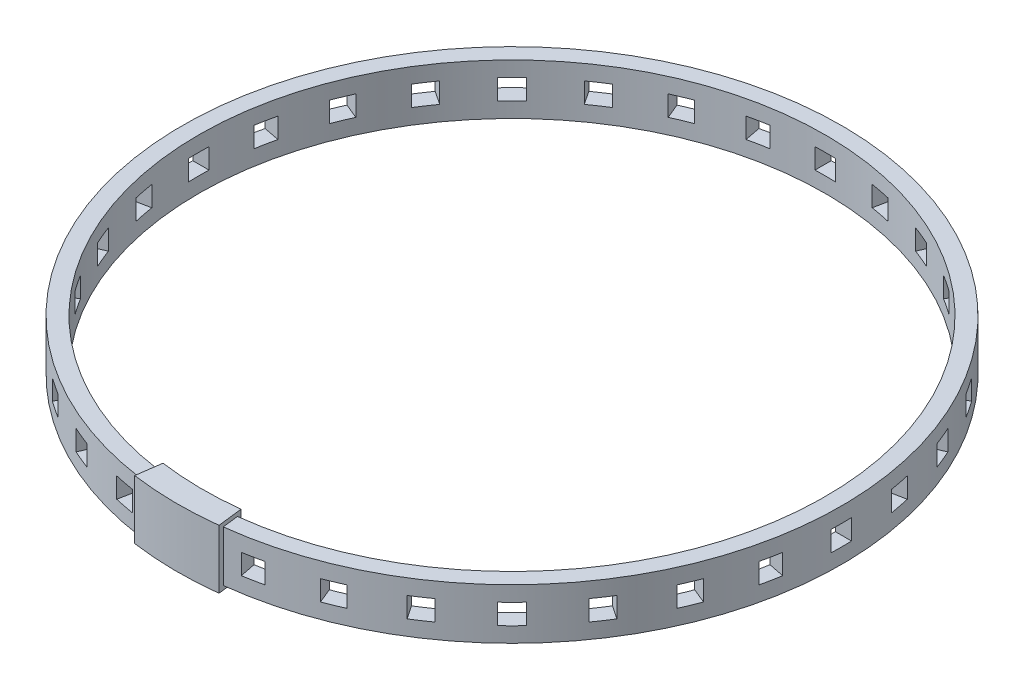
from build123d import *

# Parameters (mm, degrees)
SKETCH1_R                       = 81.15
SKETCH1_R_2                     = 77.15
BOSS_EXTRUDE1_DEPTH             = 12.5
SKETCH2_W                       = 5
SKETCH2_H                       = 5
CUT_EXTRUDE2_DEPTH              = 116.44217167
CIRPATTERN1_COUNT               = 16
CIRPATTERN1_ANGLE               = 168.75
CIRPATTERN1_THE_OTHER_WAY_COUNT = 16
CIRPATTERN1_THE_OTHER_WAY_ANGLE = 168.75
BOSS_EXTRUDE2_DEPTH             = 1
BOSS_EXTRUDE2_DEPTH_BACK        = 13.5


with BuildPart() as part:
    # Sketch1 → Boss-Extrude1 (new body)
    with BuildSketch(Plane(origin=(0, 0, 0), x_dir=(1, 0, 0), z_dir=(0, 1, 0))):
        with Locations(Location((0, 0, 0), (0, 0, 270))):
            Circle(SKETCH1_R)
        with Locations(Location((0, 0, 0), (0, 0, 270))):
            Circle(SKETCH1_R_2, mode=Mode.SUBTRACT)
    extrude(amount=BOSS_EXTRUDE1_DEPTH)

    # Sketch2 → Cut-Extrude2 (cut, through all)
    with BuildSketch(Plane.XY):
        with Locations((0, 6.25)):
            Rectangle(SKETCH2_W, SKETCH2_H)
    cut_extrude2 = extrude(amount=-CUT_EXTRUDE2_DEPTH, mode=Mode.SUBTRACT)

    # CirPattern1: Cut-Extrude2 ×16 about axis
    cirpattern1_axis = Axis((0, 0, 0), (0, 1, 0))
    for i in range(1, CIRPATTERN1_COUNT):
        add(cut_extrude2.rotate(cirpattern1_axis, i * CIRPATTERN1_ANGLE / (CIRPATTERN1_COUNT - 1)), mode=Mode.SUBTRACT)

    # CirPattern1 the other way: Cut-Extrude2 ×16 about axis
    cirpattern1_the_other_way_axis = Axis((0, 0, 0), (0, -1, 0))
    for i in range(1, CIRPATTERN1_THE_OTHER_WAY_COUNT):
        add(cut_extrude2.rotate(cirpattern1_the_other_way_axis, i * CIRPATTERN1_THE_OTHER_WAY_ANGLE / (CIRPATTERN1_THE_OTHER_WAY_COUNT - 1)), mode=Mode.SUBTRACT)

    # Sketch3 → Boss-Extrude2 (add, two sides: drawn at the far end of the back side and taken through both)
    with BuildSketch(Plane(origin=(0, 12.5, 0), x_dir=(1, 0, 0), z_dir=(0, 1, 0)).offset(-BOSS_EXTRUDE2_DEPTH_BACK)):
        with BuildLine():
            Line((-10.515914532, -75.420408654), (-11.372101927, -81.561006601))
            ThreePointArc((-11.372101927, -81.561006601), (-0.879882913, -82.345299235), (9.626699335, -81.785384757))
            Line((9.626699335, -81.785384757), (8.901920515, -75.627893737))
            ThreePointArc((8.901920515, -75.627893737), (-0.813637934, -76.145653148), (-10.515914532, -75.420408654))
        make_face()
    extrude(amount=BOSS_EXTRUDE2_DEPTH + BOSS_EXTRUDE2_DEPTH_BACK)


solid = part.part
